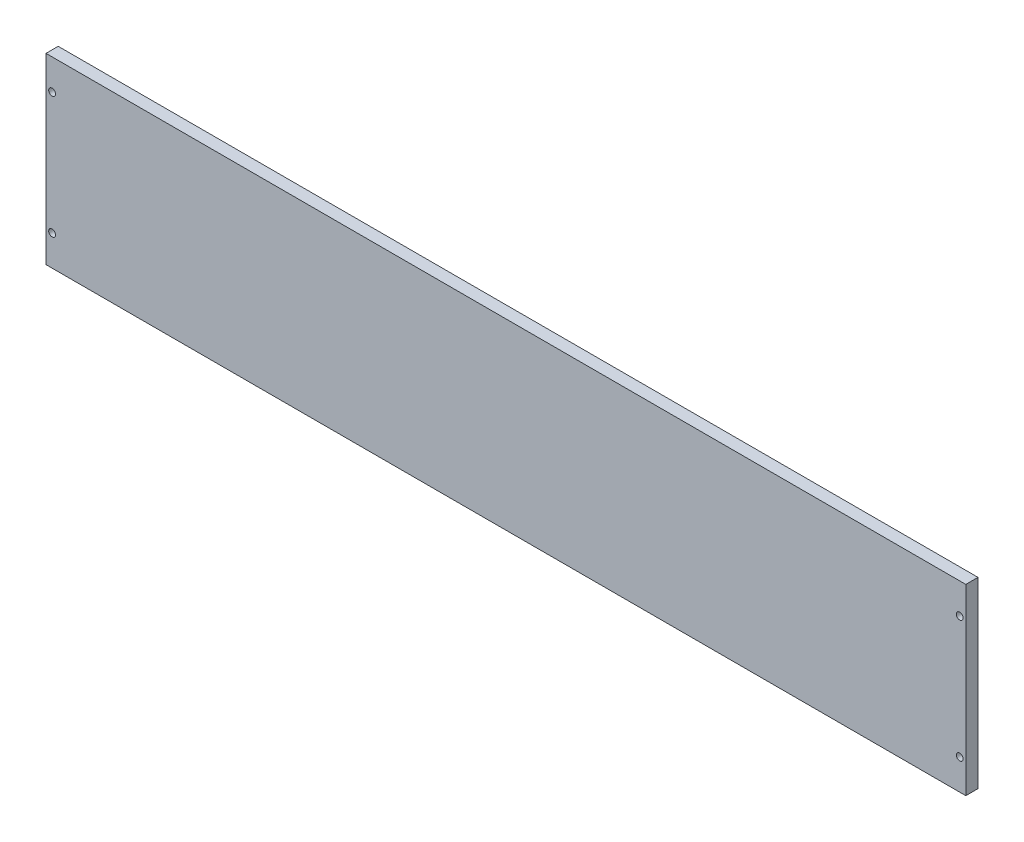
from build123d import *

# Parameters (mm, degrees)
SKETCH1_W           = 383.0066
SKETCH1_H           = 76.2
BOSS_EXTRUDE1_DEPTH = 5.08
SKETCH2_R           = 1.4224
CUT_EXTRUDE1_DEPTH  = 5.08


with BuildPart() as part:
    # Sketch1 → Boss-Extrude1 (new body)
    with BuildSketch(Plane.XY):
        with Locations((191.5033, 38.1)):
            Rectangle(SKETCH1_W, SKETCH1_H)
    extrude(amount=BOSS_EXTRUDE1_DEPTH)

    # Sketch2 → Cut-Extrude1 (cut)
    with BuildSketch(Plane.XY.offset(5.08)):
        with Locations((2.54, 63.5)):
            Circle(SKETCH2_R)
        with Locations((2.54, 12.7)):
            Circle(SKETCH2_R)
        with Locations((380.4666, 63.5)):
            Circle(SKETCH2_R)
        with Locations((380.4666, 12.7)):
            Circle(SKETCH2_R)
    extrude(amount=-CUT_EXTRUDE1_DEPTH, mode=Mode.SUBTRACT)


solid = part.part
